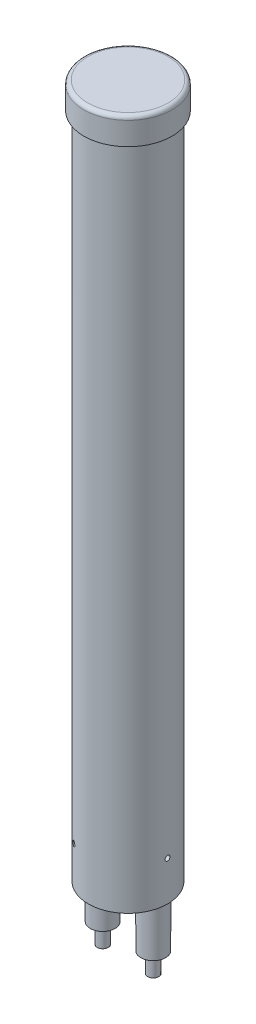
from build123d import *

# Parameters (mm, degrees)
SKETCH1_R                = 20
BOSS_EXTRUDE1_DEPTH      = 345
BOSS_EXTRUDE2_DEPTH      = 5
BOSS_EXTRUDE2_DEPTH_BACK = 8.5
SKETCH2_R                = 22.25
FILLET1_R                = 2
SKETCH3_R                = 1.25
CUT_EXTRUDE1_DEPTH       = 5
CIRPATTERN1_COUNT        = 3
SKETCH4_R                = 6.25
BOSS_EXTRUDE3_DEPTH      = 24
SKETCH5_R                = 2.8
BOSS_EXTRUDE4_DEPTH      = 10


with BuildPart() as part:
    # Sketch1 → Boss-Extrude1 (new body)
    with BuildSketch(Plane(origin=(0, 0, 0), x_dir=(1, 0, 0), z_dir=(0, 1, 0))):
        with Locations(Location((0, 0, 0), (0, 0, 270))):
            Circle(SKETCH1_R)
    extrude(amount=BOSS_EXTRUDE1_DEPTH)

    # Sketch2 → Boss-Extrude2 (add, two sides: drawn at the far end of the back side and taken through both)
    with BuildSketch(Plane(origin=(0, 345, 0), x_dir=(1, 0, 0), z_dir=(0, 1, 0)).offset(-BOSS_EXTRUDE2_DEPTH_BACK)):
        with Locations(Location((0, 0, 0), (0, 0, 270))):
            Circle(SKETCH2_R)
    extrude(amount=BOSS_EXTRUDE2_DEPTH + BOSS_EXTRUDE2_DEPTH_BACK)

    # Fillet1
    fillet1_edges = [part.edges().sort_by_distance(p)[0] for p in [
        (0, 350, -22.25),
    ]]
    fillet(fillet1_edges, radius=FILLET1_R)

    # Sketch3 → Cut-Extrude1 (cut)
    with BuildSketch(Plane(origin=(20, 0, 0), x_dir=(0, 0, -1), z_dir=(1, 0, 0))):
        with Locations((0, 20)):
            Circle(SKETCH3_R)
    cut_extrude1 = extrude(amount=-CUT_EXTRUDE1_DEPTH, mode=Mode.SUBTRACT)

    # CirPattern1: Cut-Extrude1 ×3 about axis
    cirpattern1_axis = Axis((0, 0, 0), (0, 1, 0))
    for i in range(1, CIRPATTERN1_COUNT):
        add(cut_extrude1.rotate(cirpattern1_axis, i * 360 / CIRPATTERN1_COUNT), mode=Mode.SUBTRACT)

    # Sketch4 → Boss-Extrude3 (add)
    with BuildSketch(Plane.XZ):
        with Locations(Location((-12.75, 0, 0), (0, 0, 90))):
            Circle(SKETCH4_R)
        with Locations(Location((12.75, 0, 0), (0, 0, 90))):
            Circle(SKETCH4_R)
    extrude(amount=BOSS_EXTRUDE3_DEPTH)

    # Sketch5 → Boss-Extrude4 (add)
    with BuildSketch(Plane.XZ.offset(24)):
        with Locations(Location((-12.75, 0, 0), (0, 0, 270))):
            Circle(SKETCH5_R)
        with Locations(Location((12.75, 0, 0), (0, 0, 270))):
            Circle(SKETCH5_R)
    extrude(amount=BOSS_EXTRUDE4_DEPTH)


solid = part.part
